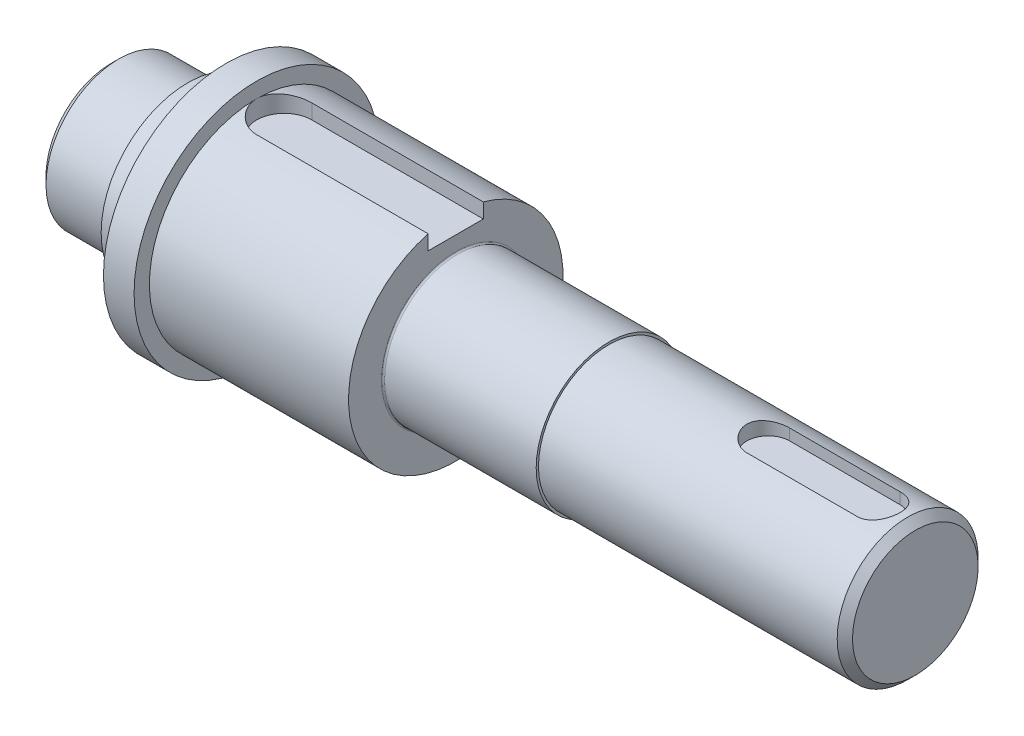
from build123d import *

# Parameters (mm, degrees)
CUT_EXTRUDE_1_DEPTH = 12
CUT_EXTRUDE_START   = 36.5
CUT_EXTRUDE_2_DEPTH = 501.552138996
CHAMFER_1_SIZE      = 5
FILLET_1_R          = 1


with BuildPart() as part:
    # 草图1 → 旋转1 (revolve)
    with BuildSketch(Plane.XY, mode=Mode.PRIVATE) as revolve_1_sk:
        Polygon((0, 0), (0, 47.5), (50, 47.5), (50, 56.5), (75, 56.5), (75, 80), (95, 80), (95, 70), (225, 70), (225, 47.5), (325, 47.5), (325, 46), (525, 46), (525, 0), align=None)
    revolve(revolve_1_sk.sketch.rotate(Axis((0, 0, 0), (1, 0, 0)), 90), axis=Axis((0, 0, 0), (1, 0, 0)))

    # 草图2 → 切除-拉伸1 (cut)
    with BuildSketch(Plane(origin=(0, 70, 0), x_dir=(-1, 0, 0), z_dir=(0, 1, 0))):
        with BuildLine():
            Line((-225, 18), (-225, -18))
            Line((-225, -18), (-113, -18))
            ThreePointArc((-113, -18), (-95, 0), (-113, 18))
            Line((-113, 18), (-225, 18))
        make_face()
    extrude(amount=-CUT_EXTRUDE_1_DEPTH, mode=Mode.SUBTRACT)

    # 草图3 → 切除-拉伸2 (cut, through all)
    with BuildSketch(Plane(origin=(0, 0, 0), x_dir=(-1, 0, 0), z_dir=(0, 1, 0)).offset(CUT_EXTRUDE_START)):
        with BuildLine():
            Line((-429, 14), (-501, 14))
            ThreePointArc((-501, 14), (-515, 0), (-501, -14))
            Line((-501, -14), (-429, -14))
            ThreePointArc((-429, -14), (-415, 0), (-429, 14))
        make_face()
    extrude(amount=CUT_EXTRUDE_2_DEPTH, mode=Mode.SUBTRACT)

    # 倒角1
    chamfer_1_edges = [part.edges().sort_by_distance(p)[0] for p in [
        (0, 0, -47.5),
        (525, 0, -46),
    ]]
    chamfer(chamfer_1_edges, length=CHAMFER_1_SIZE)

    # 圆角1
    fillet_1_edges = [part.edges().sort_by_distance(p)[0] for p in [
        (225, 0, -47.5),
    ]]
    fillet(fillet_1_edges, radius=FILLET_1_R)


solid = part.part
